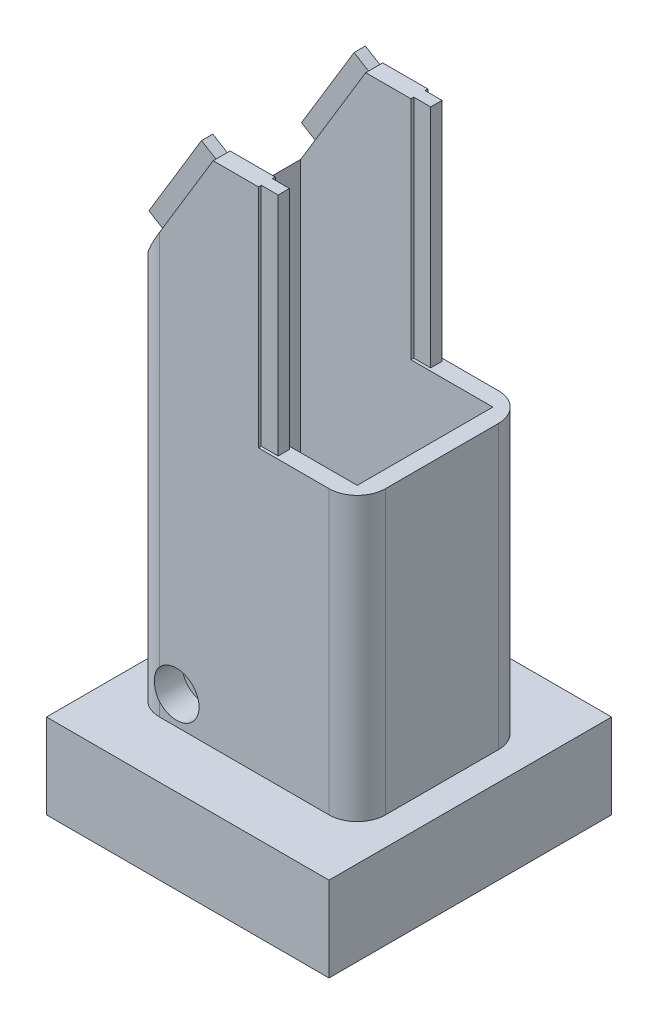
from build123d import *

# Parameters (mm, degrees)
SKETCH1_W               = 40
SKETCH1_H               = 30
BOSS_EXTRUDE1_DEPTH     = 90
SHELL1_T                = -3
FILLET1_R               = 5
CUT_EXTRUDE1_DEPTH      = 94.407708461
CUT_EXTRUDE1_DEPTH_BACK = 94.407708461
CUT_EXTRUDE2_DEPTH      = 94.407708461
CUT_EXTRUDE2_DEPTH_BACK = 94.407708461
SKETCH3_W               = 17.5
SKETCH3_H               = 40
SKETCH5_W               = 2
SKETCH5_H               = 40
BOSS_EXTRUDE2_DEPTH     = 3
SKETCH6_W               = 2
SKETCH6_H               = 18
BOSS_EXTRUDE3_DEPTH     = 3
SKETCH8_W               = 50
SKETCH8_H               = 50
BOSS_EXTRUDE4_DEPTH     = 15
SKETCH10_W              = 45
SKETCH10_H              = 10
CUT_EXTRUDE4_DEPTH      = 37.5
BOSS_EXTRUDE5_REACH     = 103.861
SKETCH15_W              = 10
SKETCH15_H              = 10
CUT_EXTRUDE8_DEPTH      = 103.988587343
CUT_EXTRUDE8_DEPTH_BACK = 103.988587343
SKETCH20_R              = 2
SKETCH21_R              = 4
CUT_EXTRUDE9_DEPTH      = 5


with BuildPart() as part:
    # Sketch1 → Boss-Extrude1 (new body)
    with BuildSketch(Plane(origin=(0, 0, 0), x_dir=(1, 0, 0), z_dir=(0, 1, 0))):
        Rectangle(SKETCH1_W, SKETCH1_H)
    extrude(amount=BOSS_EXTRUDE1_DEPTH)

    # Shell1
    shell1_openings = [part.faces().sort_by_distance(p)[0] for p in [
        (0, 90, 0),
        (0, 0, 0),
    ]]
    offset(amount=SHELL1_T, openings=shell1_openings, kind=Kind.INTERSECTION)

    # Fillet1
    fillet1_edges = [part.edges().sort_by_distance(p)[0] for p in [
        (20, 45, 15),
        (-20, 45, 15),
        (-20, 45, -15),
        (20, 45, -15),
    ]]
    fillet(fillet1_edges, radius=FILLET1_R)

    # Sketch2 → Cut-Extrude1 (cut, two sides: drawn at the far end of the back side and taken through both)
    with BuildSketch(Plane.XY.offset(-CUT_EXTRUDE1_DEPTH_BACK)):
        Polygon((-5.5, 90), (-20, 66), (-20, 90), align=None)
    extrude(amount=CUT_EXTRUDE1_DEPTH + CUT_EXTRUDE1_DEPTH_BACK, mode=Mode.SUBTRACT)

    # Sketch3 → Cut-Extrude2 (cut, two sides: drawn at the far end of the back side and taken through both)
    with BuildSketch(Plane.XY.offset(-CUT_EXTRUDE2_DEPTH_BACK)):
        with Locations((11.25, 70)):
            Rectangle(SKETCH3_W, SKETCH3_H)
    extrude(amount=CUT_EXTRUDE2_DEPTH + CUT_EXTRUDE2_DEPTH_BACK, mode=Mode.SUBTRACT)

    # Sketch5 → Boss-Extrude2 (add)
    with BuildSketch(Plane(origin=(2.5, 0, 0), x_dir=(0, 0, -1), z_dir=(1, 0, 0))):
        with Locations((-13.5, 70)):
            Rectangle(SKETCH5_W, SKETCH5_H)
    boss_extrude2 = extrude(amount=BOSS_EXTRUDE2_DEPTH)

    # Mirror1: Boss-Extrude2 across plane
    add(boss_extrude2.mirror(Plane.XY))

    # Sketch6 → Boss-Extrude3 (add)
    with BuildSketch(Plane(origin=(-43.86391097, 26.501112878, 0), x_dir=(0, 0, 1), z_dir=(-0.8559155419457907, 0.5171156399255815, 0))):
        with Locations((-13.5, 65.188262756)):
            Rectangle(SKETCH6_W, SKETCH6_H)
    boss_extrude3 = extrude(amount=BOSS_EXTRUDE3_DEPTH)

    # Mirror2: Boss-Extrude3 across plane
    add(boss_extrude3.mirror(Plane.XY))

    # Sketch8 → Boss-Extrude4 (add)
    with BuildSketch(Plane(origin=(0, 0, 0), x_dir=(1, 0, 0), z_dir=(0, 1, 0))):
        Rectangle(SKETCH8_W, SKETCH8_H)
    extrude(amount=-BOSS_EXTRUDE4_DEPTH)

    # Sketch10 → Cut-Extrude4 (cut)
    with BuildSketch(Plane.ZY.offset(25)):
        with Locations((0, -7.5)):
            Rectangle(SKETCH10_W, SKETCH10_H)
    extrude(amount=-CUT_EXTRUDE4_DEPTH, mode=Mode.SUBTRACT)

    # Sketch15 → Boss-Extrude5 (add, up to next)
    with BuildSketch(Plane.XY.offset(-12), mode=Mode.PRIVATE) as boss_extrude5_sk1:
        with Locations((-12, 5)):
            Rectangle(SKETCH15_W, SKETCH15_H)
    boss_extrude5_tool1 = extrude(boss_extrude5_sk1.sketch, amount=BOSS_EXTRUDE5_REACH, mode=Mode.PRIVATE) - part.part
    add(boss_extrude5_tool1.solids().sort_by_distance((-12, 5, -12))[0])

    # Sketch20 → Cut-Extrude8 (cut, two sides: drawn at the far end of the back side and taken through both)
    with BuildSketch(Plane(origin=(0, 0, -15), x_dir=(-1, 0, 0), z_dir=(0, 0, -1)).offset(-CUT_EXTRUDE8_DEPTH_BACK)):
        with Locations((12, 5)):
            Circle(SKETCH20_R)
    extrude(amount=CUT_EXTRUDE8_DEPTH + CUT_EXTRUDE8_DEPTH_BACK, mode=Mode.SUBTRACT)

    # Sketch21 → Cut-Extrude9 (cut)
    with BuildSketch(Plane(origin=(0, 0, -15), x_dir=(-1, 0, 0), z_dir=(0, 0, -1))):
        with Locations((12, 5)):
            Circle(SKETCH21_R)
    cut_extrude9 = extrude(amount=-CUT_EXTRUDE9_DEPTH, mode=Mode.SUBTRACT)

    # Mirror3: Cut-Extrude9 across plane
    add(cut_extrude9.mirror(Plane.XY), mode=Mode.SUBTRACT)


solid = part.part
